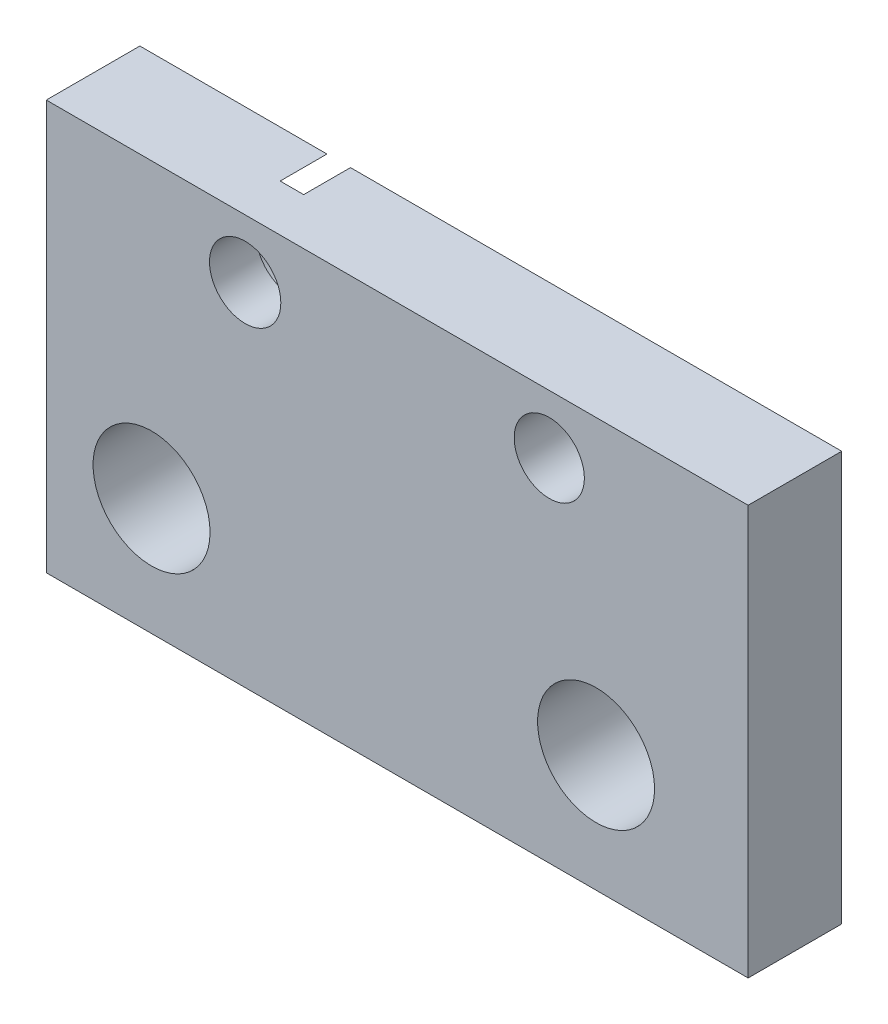
from build123d import *

# Parameters (mm, degrees)
ESQUISSE2_W             = 60
ESQUISSE2_H             = 35
BASE_EXTRUSION_DEPTH    = 8
ESQUISSE4_R             = 3.05
ESQUISSE4_R_2           = 3
ESQUISSE4_R_3           = 5
ENL_V_MAT_EXTRU_1_DEPTH = 8
ESQUISSE5_R             = 5.1
ENL_V_MAT_EXTRU_2_DEPTH = 4


with BuildPart() as part:
    # Esquisse2 → Base-Extrusion (new body)
    with BuildSketch(Plane.XY):
        with Locations((0, 7.5)):
            Rectangle(ESQUISSE2_W, ESQUISSE2_H)
    extrude(amount=BASE_EXTRUSION_DEPTH)

    # Esquisse4 → Enlèv. mat.-Extru.1 (cut)
    with BuildSketch(Plane.XY.offset(8)):
        with Locations((-13, 20)):
            Circle(ESQUISSE4_R)
        with Locations((13, 20)):
            Circle(ESQUISSE4_R_2)
        with Locations((-21, 0)):
            Circle(ESQUISSE4_R_3)
        with Locations((17, 0)):
            Circle(ESQUISSE4_R_3)
    extrude(amount=-ENL_V_MAT_EXTRU_1_DEPTH, mode=Mode.SUBTRACT)

    # Esquisse5 → Enlèv. mat.-Extru.2 (cut)
    with BuildSketch(Plane(origin=(0, 0, 0), x_dir=(-1, 0, 0), z_dir=(0, 0, -1))):
        with Locations((13, 20)):
            Circle(ESQUISSE5_R)
    extrude(amount=-ENL_V_MAT_EXTRU_2_DEPTH, mode=Mode.SUBTRACT)


solid = part.part
